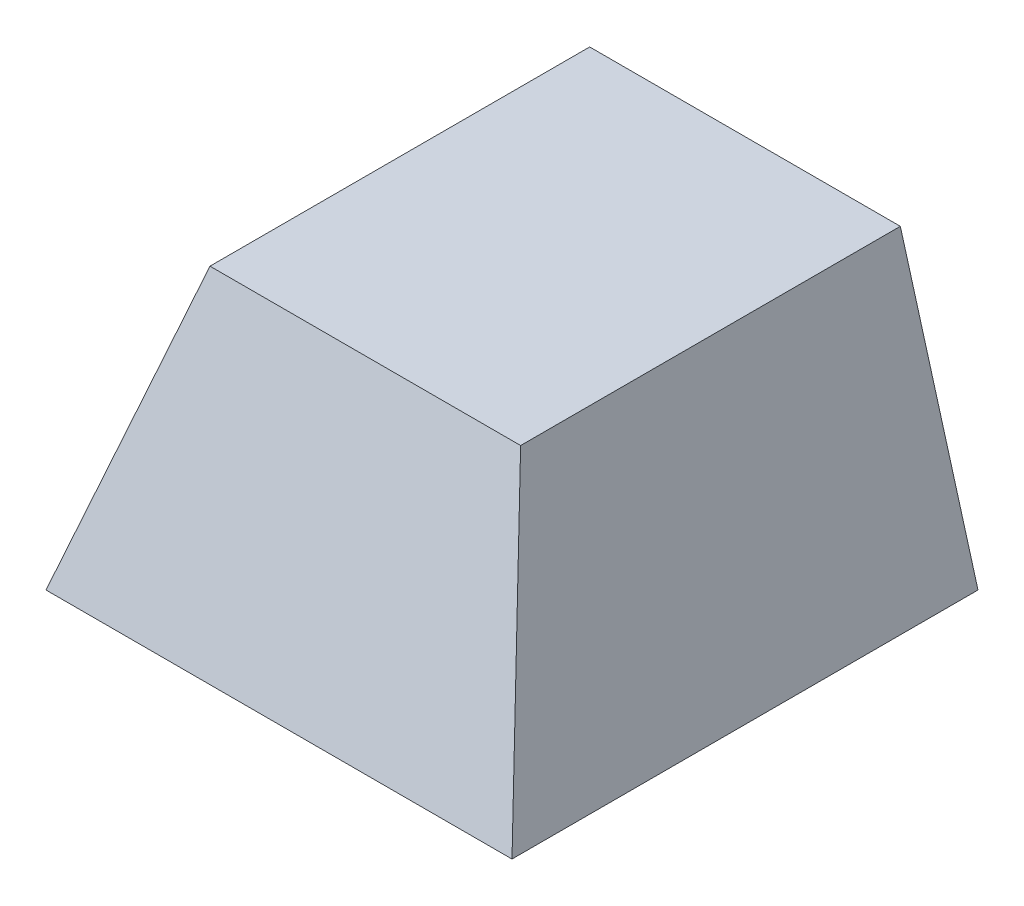
from build123d import *

# Parameters (mm, degrees)
BOSS_EXTRUDE1_DEPTH = 270
CUT_EXTRUDE2_DEPTH  = 280


with BuildPart() as part:
    # Sketch1 → Boss-Extrude1 (new body)
    with BuildSketch(Plane.XY):
        Polygon((-124.492349516, -61.642319025), (-79.492349516, 98.357680975), (100.507650484, 98.357680975), (145.507650484, -61.642319025), align=None)
    extrude(amount=BOSS_EXTRUDE1_DEPTH)

    # Sketch3 → Cut-Extrude2 (cut, along a direction that is not the sketch's normal)
    with BuildSketch(Plane(origin=(-99.300613598, 27.928297574, 0), x_dir=(0, 0, 1), z_dir=(-0.962650940153899, 0.2707455769182841, 0))):
        Polygon((270, 73.161912032), (220, 73.161912032), (270, -93.045789354), align=None)
    extrude(amount=-CUT_EXTRUDE2_DEPTH, dir=(-1, 0, 0), mode=Mode.SUBTRACT)


solid = part.part
